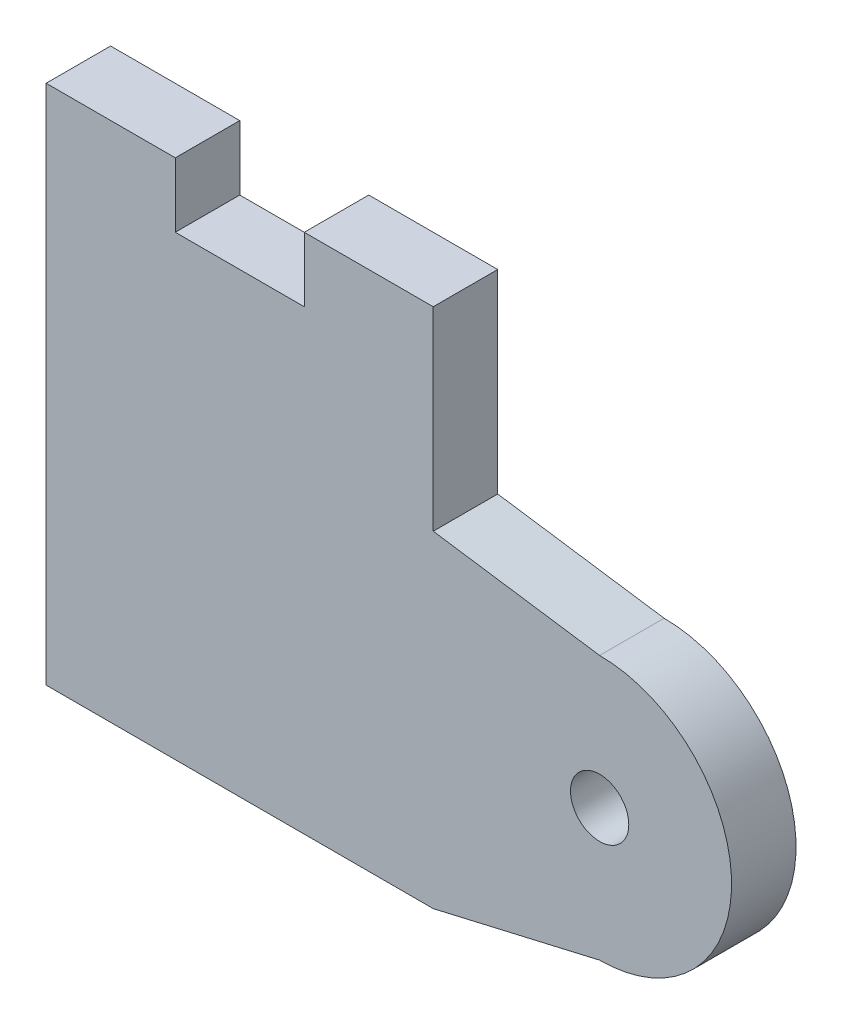
from build123d import *

# Parameters (mm, degrees)
SKETCH1_R           = 2.8702
BOSS_EXTRUDE1_DEPTH = 6.35
CUT_EXTRUDE1_DEPTH  = 166.459251888


with BuildPart() as part:
    # Sketch1 → Boss-Extrude1 (new body)
    with BuildSketch(Plane.XY):
        Polygon((126.649884677, 0), (113.949884677, 0), (113.949884677, -6.35), (101.249884677, -6.35), (101.249884677, 0), (88.530166142, 0), (88.530166142, -6.35), (88.530166142, -19.145228109), (88.530166142, -51.329150083), (157.167935302, -51.329150083), (157.167935302, -19.145228109), (126.649884677, -19.145228109), (126.649884677, -6.35), align=None)
        with Locations((143.035641266, -34.539684717)):
            Circle(SKETCH1_R, mode=Mode.SUBTRACT)
    extrude(amount=BOSS_EXTRUDE1_DEPTH)

    # Sketch2 → Cut-Extrude1 (cut, through all)
    with BuildSketch(Plane.XY.offset(6.35)):
        with BuildLine():
            Line((143.035641266, -21.547019343), (126.649884677, -19.145228109))
            Line((126.649884677, -19.145228109), (157.167935302, -19.145228109))
            Line((157.167935302, -19.145228109), (157.167935302, -51.329150083))
            Line((157.167935302, -51.329150083), (126.649884677, -51.329150083))
            Line((126.649884677, -51.329150083), (143.035641266, -47.532350091))
            ThreePointArc((143.035641266, -47.532350091), (156.028306641, -34.539684717), (143.035641266, -21.547019343))
        make_face()
    extrude(amount=-CUT_EXTRUDE1_DEPTH, mode=Mode.SUBTRACT)


solid = part.part
